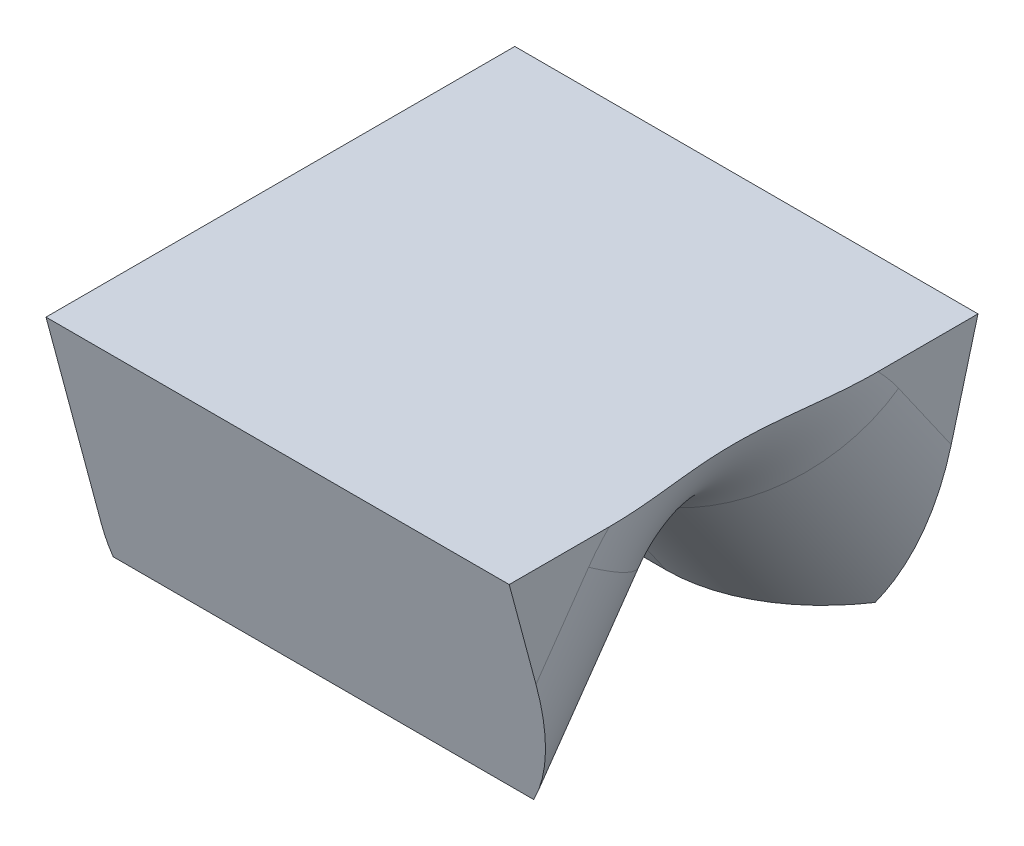
from build123d import *

# Parameters (mm, degrees)
SKETCH_TL_CUTTING_R    = 1.4986
TL_CUTTING_DEPTH       = 75.9968
SKETCH_TDF_CUTTING_W   = 3.01719996
SKETCH_TDF_CUTTING_H   = 3.01719996
TDF_CUTTING_DEPTH      = 77.026345527
VW_VR_GRINDING_DEPTH   = 1.50859998
VW_VR_GRINDING_2_DEPTH = 1.50859998
ISA_GRINDING_DEPTH     = 1.50859998
SKETCH_PRE_FRX_BRX_W   = 1.21682002
SKETCH_PRE_FRX_BRX_H   = 0.83312
SKETCH_PRE_FRX_BRX_W_2 = 1.24935996
PRE_FRX_BRX_DEPTH      = 1.50859998
FA_BA_GRINDING_DEPTH   = 1.50859998
BR_EDM_R               = 0.20066
FR_EDM_R               = 0.1016
SKETCH_ENGRAVING_W     = 0.033186299
SKETCH_ENGRAVING_H     = 1.128593452
SKETCH_ENGRAVING_H_2   = 1.128593453
ENGRAVING_DEPTH        = 0.005


with BuildPart() as part:
    # sketch_TL_cutting → TL_cutting (new body)
    with BuildSketch(Plane(origin=(0, 0, 0), x_dir=(1, 0, 0), z_dir=(0, 1, 0))):
        with Locations(Location((0, 0, 0), (0, 0, 270))):
            Circle(SKETCH_TL_CUTTING_R)
    extrude(amount=TL_CUTTING_DEPTH)

    # sketch_TDF_cutting → TDF_cutting (cut, through all)
    with BuildSketch(Plane(origin=(0, 0, 0), x_dir=(1, 0, 0), z_dir=(0, 1, 0))):
        with Locations((-2.71001998, 0)):
            Rectangle(SKETCH_TDF_CUTTING_W, SKETCH_TDF_CUTTING_H)
    extrude(amount=TDF_CUTTING_DEPTH, mode=Mode.SUBTRACT)


with BuildPart() as body_2:
    # sketch_VW_VR_grinding → VW_VR_grinding (new, symmetric)
    with BuildSketch(Plane(origin=(0, 0, 0), x_dir=(0, 0, -1), z_dir=(1, 0, 0))):
        with BuildLine():
            Line((-1.49360001, -0.00999998), (-1.49360001, 0.822008914))
            ThreePointArc((-1.49360001, 0.822008914), (-1.493648337, 0.823115792), (-1.493792952, 0.824214246))
            Line((-1.493792952, 0.824214246), (-1.51859996, 0.964901782))
            Line((-1.51859996, 0.964901782), (-1.50859998, -0.00999998))
            Line((-1.50859998, -0.00999998), (-1.49360001, -0.00999998))
        make_face()
    extrude(amount=VW_VR_GRINDING_DEPTH, both=True)


with BuildPart() as body_3:
    # sketch_VW_VR_grinding → VW_VR_grinding 2 (new, symmetric)
    with BuildSketch(Plane(origin=(0, 0, 0), x_dir=(0, 0, -1), z_dir=(1, 0, 0))):
        with BuildLine():
            Line((1.49360001, -0.00999998), (1.49360001, 0.822008914))
            ThreePointArc((1.49360001, 0.822008914), (1.493648337, 0.823115792), (1.493792952, 0.824214246))
            Line((1.493792952, 0.824214246), (1.51859996, 0.964901782))
            Line((1.51859996, 0.964901782), (1.50859998, -0.00999998))
            Line((1.50859998, -0.00999998), (1.49360001, -0.00999998))
        make_face()
    extrude(amount=VW_VR_GRINDING_2_DEPTH, both=True)


    add(body_2.part)  # ISA_grinding merges body 2
    # sketch_ISA_grinding → ISA_grinding (add, symmetric)
    with BuildSketch(Plane(origin=(0, 0, 0), x_dir=(0, 0, -1), z_dir=(1, 0, 0))):
        Polygon((-0.19939, 0), (0.19939, 0), (1.50859998, 4.886038163), (1.50859998, -0.02999994), (-1.50859998, -0.02999994), (-1.50859998, 4.886038163), align=None)
    extrude(amount=ISA_GRINDING_DEPTH, both=True)

    # sketch_pre_FRX_BRX → pre_FRX_BRX (add, symmetric)
    with BuildSketch(Plane.XY):
        with Locations((0.89018999, 0.40656002)):
            Rectangle(SKETCH_PRE_FRX_BRX_W, SKETCH_PRE_FRX_BRX_H)
        with Locations((-0.89391998, 0.40656002)):
            Rectangle(SKETCH_PRE_FRX_BRX_W_2, SKETCH_PRE_FRX_BRX_H)
    extrude(amount=PRE_FRX_BRX_DEPTH, both=True)

    # sketch_FA_BA_grinding → FA_BA_grinding (add, symmetric)
    with BuildSketch(Plane.XY):
        Polygon((0.27178, -0.00999998), (0.27178, 0.83312), (1.6256, 10.466049838), (1.6256, -0.00999998), align=None)
        Polygon((-0.26924, -0.00999998), (-0.26924, 0.83312), (-1.32842, 8.369577303), (-1.32842, -0.00999998), align=None)
    extrude(amount=FA_BA_GRINDING_DEPTH, both=True)


with BuildPart() as part_1:
    add(part.part)

    # B1_fix: cut body 3
    add(body_3.part, mode=Mode.SUBTRACT)

    # V-Groove_EDM: sweep along a path in sketch_contour_V-Groove
    with BuildLine(Plane.XY) as v_groove_edm_path:
        Line((-1.20142, 0.14224), (1.4986, 0.14224))
    # sketch_section_V-Groove → V-Groove_EDM (sweep, cut)
    with BuildSketch(Plane(origin=(-1.20142, 0, -1.2954), x_dir=(0, 0, -1), z_dir=(1, 0, 0))):
        with BuildLine():
            Line((-1.27875483, 0.133575073), (-1.178222496, -0.00999998))
            Line((-1.178222496, -0.00999998), (-1.412577504, -0.00999998))
            Line((-1.412577504, -0.00999998), (-1.31204517, 0.133575073))
            ThreePointArc((-1.31204517, 0.133575073), (-1.2954, 0.14224), (-1.27875483, 0.133575073))
        make_face()
    sweep(path=v_groove_edm_path.line, mode=Mode.SUBTRACT)

    # BR_EDM
    br_edm_edges = [part_1.edges().sort_by_distance(p)[0] for p in [
        (0.27178, 0.066787537, -0.063410306),
        (0.27178, 0.14224, 0),
        (0.27178, 0.066787537, 0.063410306),
    ]]
    fillet(br_edm_edges, radius=BR_EDM_R)

    # FR_EDM
    fr_edm_edges = [part_1.edges().sort_by_distance(p)[0] for p in [
        (-0.26924, 0.14224, 0),
        (-0.26924, 0.066787537, -0.063410306),
        (-0.26924, 0.066787537, 0.063410306),
    ]]
    fillet(fr_edm_edges, radius=FR_EDM_R)

    # sketch_Engraving → Engraving (cut)
    # profile 1 of 14: a face of its own
    with BuildSketch(Plane.ZY.offset(1.20142)):
        Polygon((0.531688452, 45.269846756), (0.531688452, 44.551415224), (0.030264207, 44.92787231), (0.030264207, 44.765052028), (-0.034552784, 44.633862437), (-0.102740259, 44.56723057), (-0.296154161, 44.503450651), (-0.425528876, 44.503450651), (-0.618942778, 44.56723057), (-0.749354564, 44.69842016), (-0.81235668, 44.891834063), (-0.81235668, 45.083433089), (-0.749354564, 45.276846991), (-0.682722697, 45.345293734), (-0.555940662, 45.408295849), (-0.541940192, 45.382887589), (-0.665351744, 45.320663277), (-0.724724108, 45.262846521), (-0.785133544, 45.080062605), (-0.785133544, 44.895463814), (-0.724724108, 44.712420631), (-0.604164504, 44.592638831), (-0.42112132, 44.531451591), (-0.299524645, 44.531451591), (-0.116740729, 44.592638831), (-0.059701777, 44.652270463), (0.001485463, 44.772052263), (0.001485463, 44.985429798), (0.502909708, 44.60923198), (0.502909708, 45.269846756), align=None)
    # profile 2 of 14: a face of its own
    with BuildSketch(Plane.ZY.offset(1.20142)):
        Polygon((-0.79576353, 43.729743189), (-0.79576353, 43.758521933), (0.483723879, 43.758521933), (0.316755309, 43.923157091), (0.254530997, 44.049939126), (0.278902186, 44.064976668), (0.341904302, 43.940528044), (0.531688452, 43.74996609), (0.531688452, 43.729743189), align=None)
    # profile 3 of 14: a face of its own
    with BuildSketch(Plane.ZY.offset(1.20142)):
        Polygon((-0.79576353, 42.579837909), (-0.79576353, 42.608616653), (0.483723879, 42.608616653), (0.316755309, 42.773251811), (0.254530997, 42.900033846), (0.278902186, 42.915071388), (0.341904302, 42.790622765), (0.531688452, 42.60006081), (0.531688452, 42.579837909), align=None)
    # profile 4 of 14: a face of its own
    with BuildSketch(Plane.ZY.offset(1.20142)):
        Polygon((-0.786170615, 41.055549687), (-0.79576353, 41.079920876), (-0.367193584, 41.245333838), (-0.367193584, 41.893763019), (-0.79576353, 42.059175981), (-0.786170615, 42.08354717), (0.531688452, 41.578752441), (0.531688452, 41.559566612), align=None)
        Polygon((-0.340748251, 41.255704557), (0.478538519, 41.569159527), (-0.340748251, 41.883133033), align=None, mode=Mode.SUBTRACT)
    # profile 5 of 14: a face of its own
    with BuildSketch(Plane.ZY.offset(1.20142)):
        with Locations((-0.231596438, 40.285083075)):
            Rectangle(SKETCH_ENGRAVING_W, SKETCH_ENGRAVING_H)
    # profile 6 of 14: a face of its own
    with BuildSketch(Plane.ZY.offset(1.20142)):
        Polygon((0.515095302, 38.490248732), (-0.79576353, 38.988821029), (-0.79576353, 39.018636845), (0.521058466, 39.518246214), (0.531688452, 39.493875025), (-0.756354799, 39.003858571), (0.525466021, 38.514619921), align=None)
    # profile 7 of 14: a face of its own
    with BuildSketch(Plane.ZY.offset(1.20142)):
        Polygon((-0.786170615, 38.108295165), (0.502909708, 37.49227448), (0.502909708, 38.347080961), (0.531688452, 38.347080961), (0.531688452, 37.44508771), (-0.79576353, 38.083664709), align=None)
    # profile 8 of 14: a face of its own
    with BuildSketch(Plane.ZY.offset(1.20142)):
        Polygon((-0.554125786, 36.366740389), (-0.749354564, 36.498189247), (-0.81235668, 36.693158757), (-0.81235668, 36.82279274), (-0.749354564, 37.01776225), (-0.554125786, 37.148174036), (-0.237559601, 37.211176152), (-0.044923503, 37.211176152), (0.271901951, 37.148174036), (0.466871461, 37.01776225), (0.531688452, 36.82279274), (0.531688452, 36.693158757), (0.466871461, 36.498189247), (0.271901951, 36.366740389), (-0.044923503, 36.304775345), (-0.237559601, 36.304775345), align=None)
        Polygon((-0.539347512, 36.395778401), (-0.22874449, 36.332776285), (-0.044923503, 36.332776285), (0.26567952, 36.395778401), (0.446907827, 36.515560201), (0.507057995, 36.696788509), (0.507057995, 36.818385184), (0.446907827, 36.999613492), (0.26567952, 37.120173096), (-0.044923503, 37.182397408), (-0.22874449, 37.182397408), (-0.539347512, 37.120173096), (-0.72057582, 36.999613492), (-0.780985256, 36.818385184), (-0.780985256, 36.696788509), (-0.72057582, 36.515560201), align=None, mode=Mode.SUBTRACT)
    # profile 9 of 14: a face of its own
    with BuildSketch(Plane.ZY.offset(1.20142)):
        with Locations((-0.231596438, 35.419971561)):
            Rectangle(SKETCH_ENGRAVING_W, SKETCH_ENGRAVING_H_2)
    # profile 10 of 14: a face of its own
    with BuildSketch(Plane.ZY.offset(1.20142)):
        Polygon((-0.541940192, 34.502759279), (-0.665351744, 34.440534968), (-0.724724108, 34.382718211), (-0.785133544, 34.199934296), (-0.785133544, 34.015335505), (-0.724724108, 33.832292321), (-0.604164504, 33.712510521), (-0.42112132, 33.651323281), (-0.299524645, 33.651323281), (-0.116740729, 33.712510521), (0.003041071, 33.832292321), (0.064487579, 34.015335505), (0.064487579, 34.199934296), (0.003041071, 34.382718211), (-0.086924913, 34.470350784), (0.531688452, 34.402941113), (0.531688452, 33.762289971), (0.502909708, 33.762289971), (0.502909708, 34.377532852), (-0.007329648, 34.434312537), (0.028449332, 34.396718682), (0.092488519, 34.203304779), (0.092488519, 34.011705753), (0.028449332, 33.818291851), (-0.102740259, 33.687102261), (-0.296154161, 33.623322341), (-0.425528876, 33.623322341), (-0.618942778, 33.687102261), (-0.749354564, 33.818291851), (-0.81235668, 34.011705753), (-0.81235668, 34.203304779), (-0.749354564, 34.396718682), (-0.682722697, 34.465165424), (-0.555940662, 34.52816754), align=None)
    # profile 11 of 14: a face of its own
    with BuildSketch(Plane.ZY.offset(1.20142)):
        Polygon((-0.554125786, 32.535382105), (-0.749354564, 32.666830964), (-0.81235668, 32.861800473), (-0.81235668, 32.991434456), (-0.749354564, 33.186403966), (-0.554125786, 33.316815753), (-0.237559601, 33.379817868), (-0.044923503, 33.379817868), (0.271901951, 33.316815753), (0.466871461, 33.186403966), (0.531688452, 32.991434456), (0.531688452, 32.861800473), (0.466871461, 32.666830964), (0.271901951, 32.535382105), (-0.044923503, 32.473417061), (-0.237559601, 32.473417061), align=None)
        Polygon((-0.539347512, 32.564420117), (-0.22874449, 32.501418002), (-0.044923503, 32.501418002), (0.26567952, 32.564420117), (0.446907827, 32.684201917), (0.507057995, 32.865430225), (0.507057995, 32.987026901), (0.446907827, 33.168255208), (0.26567952, 33.288814812), (-0.044923503, 33.351039124), (-0.22874449, 33.351039124), (-0.539347512, 33.288814812), (-0.72057582, 33.168255208), (-0.780985256, 32.987026901), (-0.780985256, 32.865430225), (-0.72057582, 32.684201917), align=None, mode=Mode.SUBTRACT)
    # profile 12 of 14: a face of its own
    with BuildSketch(Plane.ZY.offset(1.20142)):
        Polygon((-0.554125786, 31.385476826), (-0.749354564, 31.516925684), (-0.81235668, 31.711895194), (-0.81235668, 31.841529177), (-0.749354564, 32.036498686), (-0.554125786, 32.166910473), (-0.237559601, 32.229912589), (-0.044923503, 32.229912589), (0.271901951, 32.166910473), (0.466871461, 32.036498686), (0.531688452, 31.841529177), (0.531688452, 31.711895194), (0.466871461, 31.516925684), (0.271901951, 31.385476826), (-0.044923503, 31.323511782), (-0.237559601, 31.323511782), align=None)
        Polygon((-0.539347512, 31.414514838), (-0.22874449, 31.351512722), (-0.044923503, 31.351512722), (0.26567952, 31.414514838), (0.446907827, 31.534296638), (0.507057995, 31.715524945), (0.507057995, 31.837121621), (0.446907827, 32.018349929), (0.26567952, 32.138909533), (-0.044923503, 32.201133844), (-0.22874449, 32.201133844), (-0.539347512, 32.138909533), (-0.72057582, 32.018349929), (-0.780985256, 31.837121621), (-0.780985256, 31.715524945), (-0.72057582, 31.534296638), align=None, mode=Mode.SUBTRACT)
    # profile 13 of 14: a face of its own
    with BuildSketch(Plane.ZY.offset(1.20142)):
        with Locations((-0.231596438, 30.438707997)):
            Rectangle(SKETCH_ENGRAVING_W, SKETCH_ENGRAVING_H_2)
    # profile 14 of 14: a face of its own
    with BuildSketch(Plane.ZY.offset(1.20142)):
        Polygon((-0.79576353, 29.018256595), (-0.79576353, 29.04703534), (0.483723879, 29.04703534), (0.316755309, 29.211670497), (0.254530997, 29.338452532), (0.278902186, 29.353490074), (0.341904302, 29.229041451), (0.531688452, 29.038479497), (0.531688452, 29.018256595), align=None)
    extrude(amount=-ENGRAVING_DEPTH, mode=Mode.SUBTRACT)

    # SurfaceCut1
    split(bisect_by=Plane(origin=(0, 0.277595628, 0), x_dir=(1, 0, 0), z_dir=(0, 1, 0)), keep=Keep.BOTTOM)


solid = part_1.part
